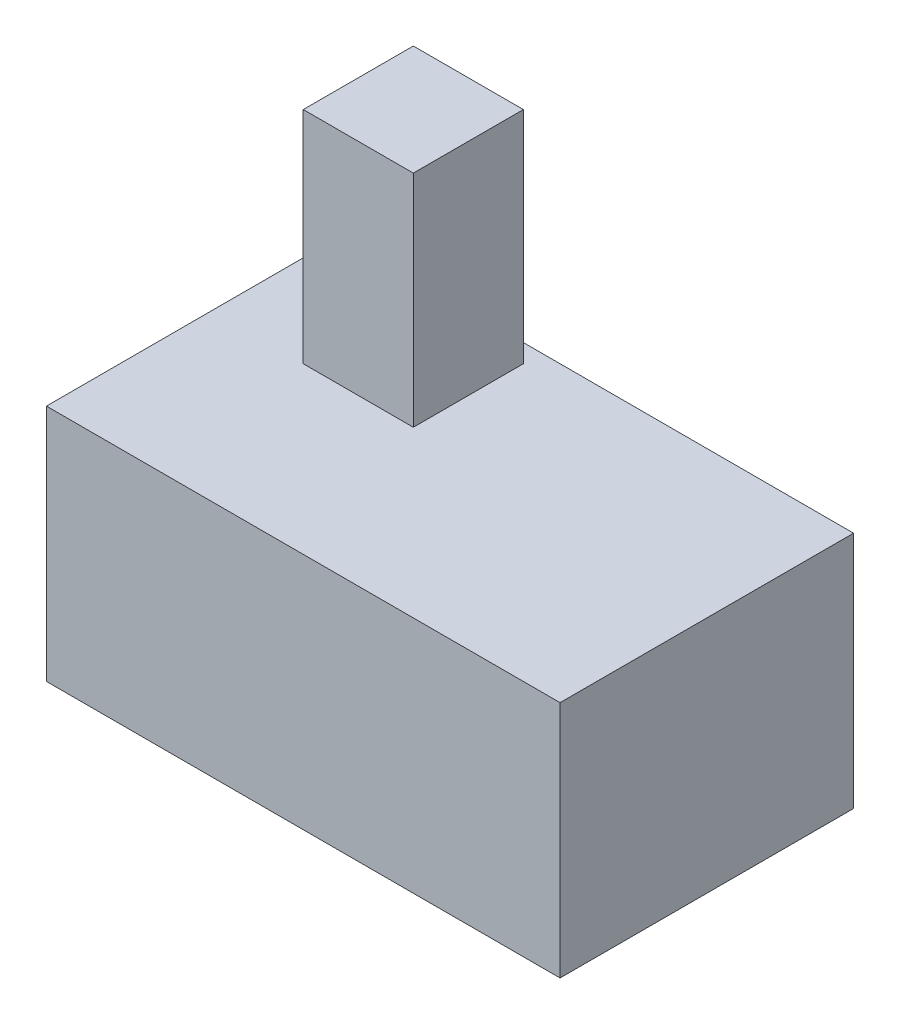
from build123d import *

# Parameters (mm, degrees)
SKETCH1_W           = 14
SKETCH1_H           = 8
BOSS_EXTRUDE1_DEPTH = 6.5
SKETCH2_W           = 3
SKETCH2_H           = 3
BOSS_EXTRUDE2_DEPTH = 6


with BuildPart() as part:
    # Sketch1 → Boss-Extrude1 (new body)
    with BuildSketch(Plane(origin=(0, 0, 0), x_dir=(1, 0, 0), z_dir=(0, 1, 0))):
        Rectangle(SKETCH1_W, SKETCH1_H)
    extrude(amount=BOSS_EXTRUDE1_DEPTH)

    # Sketch2 → Boss-Extrude2 (add)
    with BuildSketch(Plane(origin=(0, 6.5, 0), x_dir=(1, 0, 0), z_dir=(0, 1, 0))):
        with Locations((-3, 2)):
            Rectangle(SKETCH2_W, SKETCH2_H)
    extrude(amount=BOSS_EXTRUDE2_DEPTH)


solid = part.part
